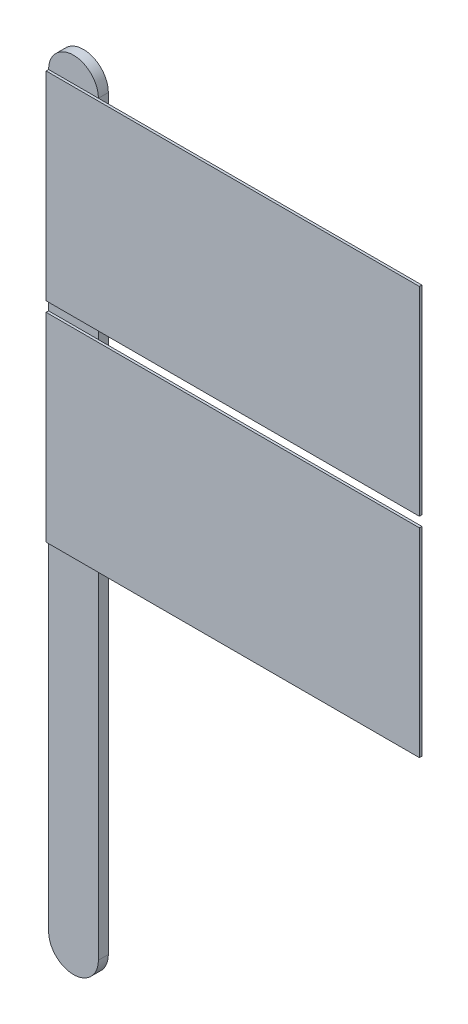
from build123d import *

# Parameters (mm, degrees)
BOSS_EXTRU_1_DEPTH = 2
ESQUISSE2_W        = 75
ESQUISSE2_H        = 40
BOSS_EXTRU_2_DEPTH = 0.5


with BuildPart() as part:
    # Esquisse1 → Boss.-Extru.1 (new body)
    with BuildSketch(Plane.XY):
        with BuildLine():
            Line((-5, 0), (-5, 150))
            ThreePointArc((-5, 150), (0, 155), (5, 150))
            Line((5, 150), (5, 0))
            ThreePointArc((5, 0), (0, -5), (-5, 0))
        make_face()
    extrude(amount=BOSS_EXTRU_1_DEPTH)

    # Esquisse2 → Boss.-Extru.2 (add)
    with BuildSketch(Plane.XY.offset(2)):
        with Locations((32.5, 130)):
            Rectangle(ESQUISSE2_W, ESQUISSE2_H)
        with Locations((32.5, 88)):
            Rectangle(ESQUISSE2_W, ESQUISSE2_H)
    extrude(amount=BOSS_EXTRU_2_DEPTH)


solid = part.part
